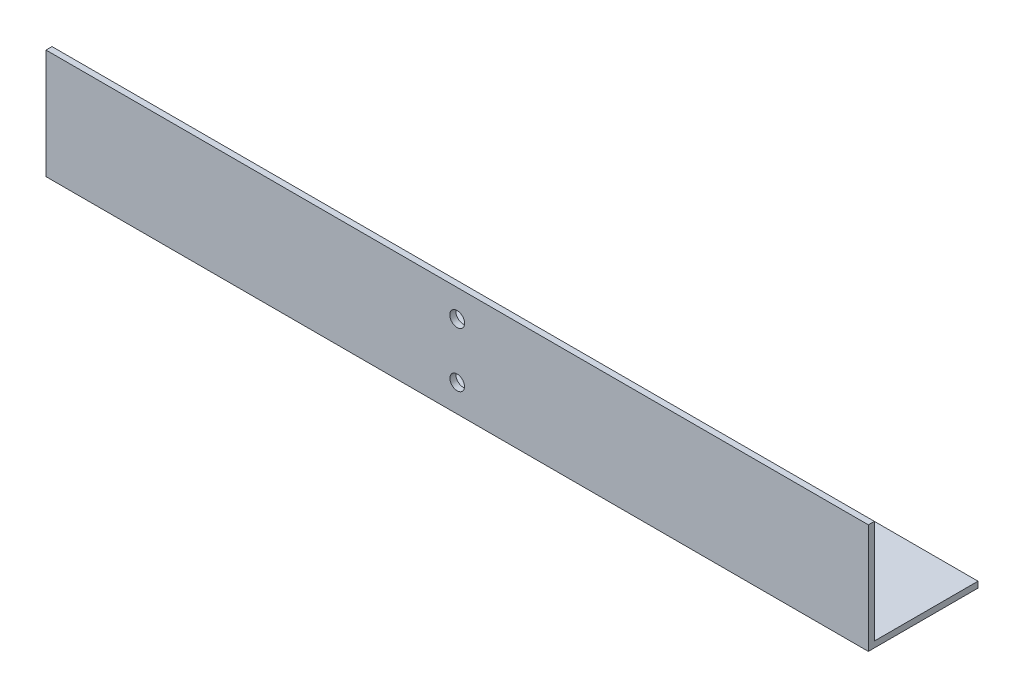
from build123d import *

# Parameters (mm, degrees)
SKETCH1_W           = 381
SKETCH1_H           = 50.8
BOSS_EXTRUDE1_DEPTH = 2.794
SKETCH2_W           = 381
SKETCH2_H           = 2.794
BOSS_EXTRUDE2_DEPTH = 48.006
SKETCH3_R           = 3.429
SKETCH3_R_2         = 3.3734375
CUT_EXTRUDE1_DEPTH  = 2.794


with BuildPart() as part:
    # Sketch1 → Boss-Extrude1 (new body)
    with BuildSketch(Plane(origin=(0, 0, 0), x_dir=(1, 0, 0), z_dir=(0, 1, 0))):
        Rectangle(SKETCH1_W, SKETCH1_H)
    extrude(amount=BOSS_EXTRUDE1_DEPTH)

    # Sketch2 → Boss-Extrude2 (add)
    with BuildSketch(Plane(origin=(0, 2.794, 0), x_dir=(1, 0, 0), z_dir=(0, 1, 0))):
        with Locations((0, -24.003)):
            Rectangle(SKETCH2_W, SKETCH2_H)
    extrude(amount=BOSS_EXTRUDE2_DEPTH)

    # Sketch3 → Cut-Extrude1 (cut)
    with BuildSketch(Plane.XY.offset(25.4)):
        with Locations((0, 38.1)):
            Circle(SKETCH3_R)
        with Locations((0, 12.7)):
            Circle(SKETCH3_R_2)
    extrude(amount=-CUT_EXTRUDE1_DEPTH, mode=Mode.SUBTRACT)


solid = part.part
